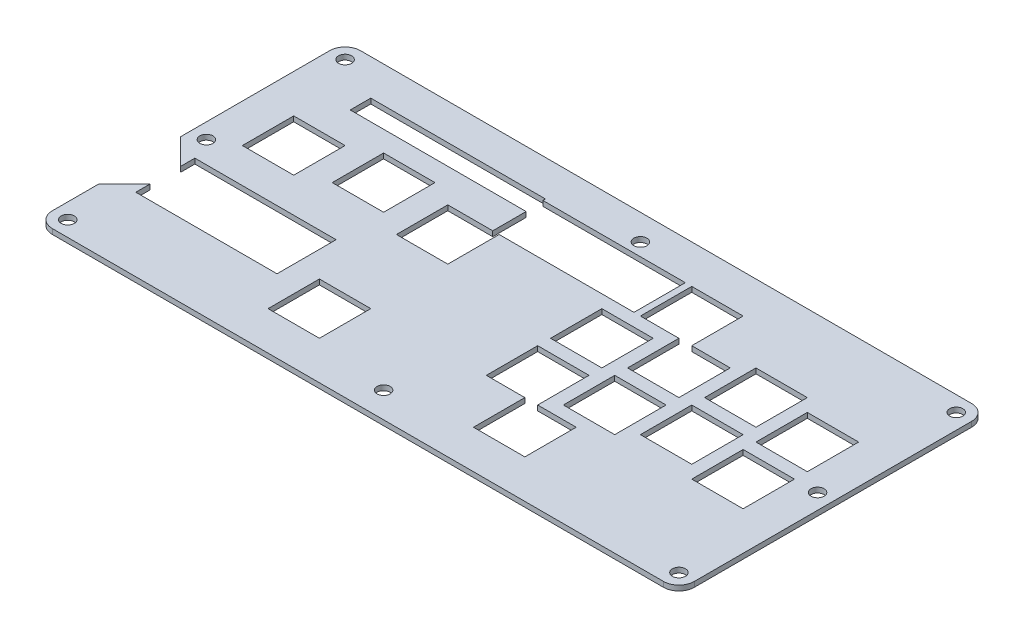
from build123d import *

# Parameters (mm, degrees)
SKETCH_1_R      = 2.55
SKETCH_1_W      = 20
SKETCH_1_H      = 20
EXTRUDE_1_DEPTH = 2


with BuildPart() as part:
    # 草图1 → 凸台-拉伸1 (new body)
    with BuildSketch(Plane(origin=(0, 0, 0), x_dir=(1, 0, 0), z_dir=(0, 1, 0))):
        with BuildLine():
            Line((15.755708479, 65.523244106), (15.755708479, 123.523244106))
            ThreePointArc((15.755708479, 123.523244106), (17.513067792, 127.765884793), (21.755708479, 129.523244106))
            Line((21.755708479, 129.523244106), (259.755708479, 129.523244106))
            ThreePointArc((259.755708479, 129.523244106), (263.998349166, 127.765884793), (265.755708479, 123.523244106))
            Line((265.755708479, 123.523244106), (265.755708479, 15.523244106))
            ThreePointArc((265.755708479, 15.523244106), (263.998349166, 11.280603419), (259.755708479, 9.523244106))
            Line((259.755708479, 9.523244106), (21.755708479, 9.523244106))
            ThreePointArc((21.755708479, 9.523244106), (17.513067792, 11.280603419), (15.755708479, 15.523244106))
            Line((15.755708479, 15.523244106), (15.755708479, 33.523244106))
            Line((15.755708479, 33.523244106), (25.755708479, 43.523244106))
            Line((25.755708479, 43.523244106), (25.755708479, 38.023244106))
            Line((25.755708479, 38.023244106), (80.755708479, 38.023244106))
            Line((80.755708479, 38.023244106), (80.755708479, 61.023244106))
            Line((80.755708479, 61.023244106), (25.755708479, 61.023244106))
            Line((25.755708479, 61.023244106), (25.755708479, 55.523244106))
            Line((25.755708479, 55.523244106), (15.755708479, 65.523244106))
        make_face()
        with Locations(Location((21.755708479, 123.523244106, 0), (0, 0, 270))):
            Circle(SKETCH_1_R, mode=Mode.SUBTRACT)
        with Locations(Location((259.755708479, 123.523244106, 0), (0, 0, 270))):
            Circle(SKETCH_1_R, mode=Mode.SUBTRACT)
        with Locations(Location((140.755708479, 119.523244106, 0), (0, 0, 270))):
            Circle(SKETCH_1_R, mode=Mode.SUBTRACT)
        with Locations(Location((21.755708479, 15.523244106, 0), (0, 0, 270))):
            Circle(SKETCH_1_R, mode=Mode.SUBTRACT)
        with Locations(Location((259.755708479, 15.523244106, 0), (0, 0, 270))):
            Circle(SKETCH_1_R, mode=Mode.SUBTRACT)
        with Locations(Location((140.755708479, 19.523244106, 0), (0, 0, 270))):
            Circle(SKETCH_1_R, mode=Mode.SUBTRACT)
        with Locations(Location((259.755708479, 69.523244106, 0), (0, 0, 270))):
            Circle(SKETCH_1_R, mode=Mode.SUBTRACT)
        with Locations(Location((21.755708479, 69.523244106, 0), (0, 0, 270))):
            Circle(SKETCH_1_R, mode=Mode.SUBTRACT)
        Polygon((107.755708479, 107.523244106), (39.755708479, 107.523244106), (39.755708479, 115.523244106), (107.755708479, 115.523244106), (107.755708479, 114.523244106), (108.255708479, 114.523244106), (163.255708479, 114.523244106), (163.255708479, 94.523244106), (110.755708479, 94.523244106), (110.755708479, 74.523244106), (90.755708479, 74.523244106), (90.755708479, 94.523244106), (108.255708479, 94.523244106), (108.255708479, 107.523244106), align=None, mode=Mode.SUBTRACT)
        with Locations((70.755708479, 89.523244106)):
            Rectangle(SKETCH_1_W, SKETCH_1_H, mode=Mode.SUBTRACT)
        with Locations((100.755708479, 34.523244106)):
            Rectangle(SKETCH_1_W, SKETCH_1_H, mode=Mode.SUBTRACT)
        with Locations((40.755708479, 84.523244106)):
            Rectangle(SKETCH_1_W, SKETCH_1_H, mode=Mode.SUBTRACT)
        Polygon((180.755708479, 94.523244106), (165.755708479, 94.523244106), (165.755708479, 114.523244106), (185.755708479, 114.523244106), (185.755708479, 94.523244106), (200.755708479, 94.523244106), (200.755708479, 74.523244106), (180.755708479, 74.523244106), align=None, mode=Mode.SUBTRACT)
        with Locations((165.755708479, 79.523244106)):
            Rectangle(SKETCH_1_W, SKETCH_1_H, mode=Mode.SUBTRACT)
        with Locations((215.755708479, 89.523244106)):
            Rectangle(SKETCH_1_W, SKETCH_1_H, mode=Mode.SUBTRACT)
        with Locations((240.755708479, 84.523244106)):
            Rectangle(SKETCH_1_W, SKETCH_1_H, mode=Mode.SUBTRACT)
        Polygon((170.755708479, 44.523244106), (155.755708479, 44.523244106), (155.755708479, 64.523244106), (175.755708479, 64.523244106), (175.755708479, 44.523244106), (190.755708479, 44.523244106), (190.755708479, 24.523244106), (170.755708479, 24.523244106), align=None, mode=Mode.SUBTRACT)
        with Locations((190.755708479, 59.523244106)):
            Rectangle(SKETCH_1_W, SKETCH_1_H, mode=Mode.SUBTRACT)
        with Locations((215.755708479, 64.523244106)):
            Rectangle(SKETCH_1_W, SKETCH_1_H, mode=Mode.SUBTRACT)
        with Locations((240.755708479, 59.523244106)):
            Rectangle(SKETCH_1_W, SKETCH_1_H, mode=Mode.SUBTRACT)
    extrude(amount=EXTRUDE_1_DEPTH)


solid = part.part
